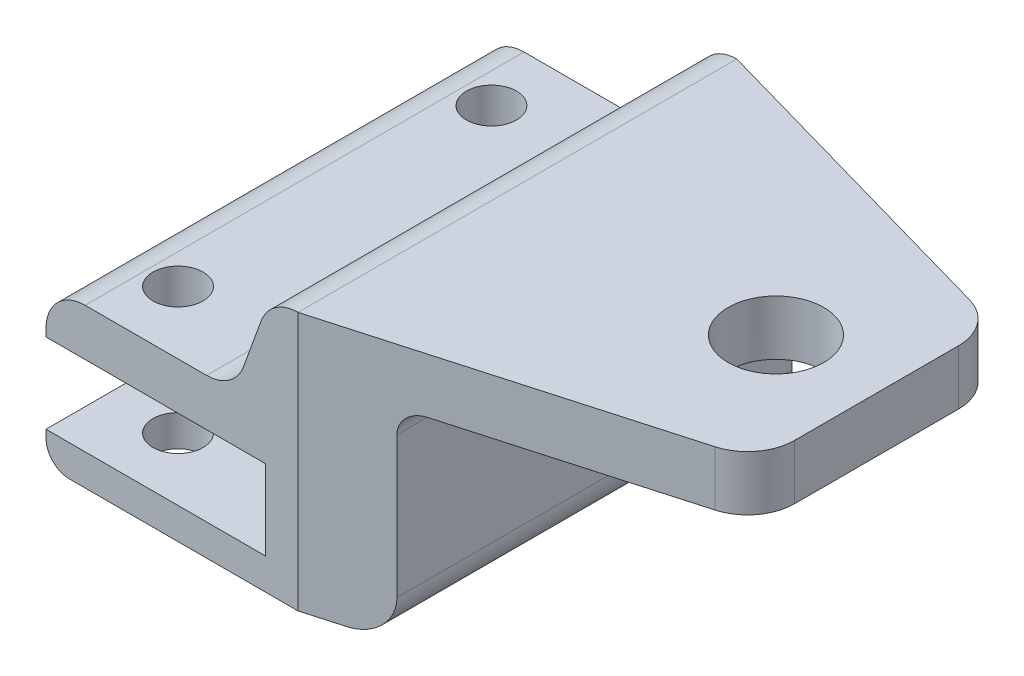
from build123d import *

# Parameters (mm, degrees)
BOSS_EXTRU_1_DEPTH      = 28
ESQUISSE2_R             = 1.6
ENL_V_MAT_EXTRU_1_DEPTH = 53.297323067
ESQUISSE3_R             = 3.05
ENL_V_MAT_EXTRU_2_DEPTH = 54.900371056


with BuildPart() as part:
    # Esquisse1 → Boss.-Extru.1 (new body)
    with BuildSketch(Plane.XY):
        with BuildLine():
            Line((1.5, 0), (18.5, 0))
            ThreePointArc((18.5, 0), (20.267766953, 0.732233047), (21, 2.5))
            Line((21, 2.5), (21, 11.5))
            ThreePointArc((21, 11.5), (21.439339828, 12.560660172), (22.5, 13))
            Line((22.5, 13), (43, 13))
            Line((43, 13), (43, 16.5))
            Line((43, 16.5), (16.079928345, 16.5))
            ThreePointArc((16.079928345, 16.5), (14.645987254, 16.047880111), (13.730696793, 14.855050358))
            Line((13.730696793, 14.855050358), (12.598712706, 11.744949642))
            ThreePointArc((12.598712706, 11.744949642), (11.683422245, 10.552119889), (10.249481154, 10.1))
            Line((10.249481154, 10.1), (2.5, 10.1))
            ThreePointArc((2.5, 10.1), (0.732233047, 9.367766953), (0, 7.6))
            Line((0, 7.6), (0, 7.1))
            Line((0, 7.1), (14, 7.1))
            Line((14, 7.1), (14, 2))
            Line((14, 2), (0, 2))
            Line((0, 2), (0, 1.5))
            ThreePointArc((0, 1.5), (0.439339828, 0.439339828), (1.5, 0))
        make_face()
    extrude(amount=BOSS_EXTRU_1_DEPTH)

    # Esquisse2 → Enlèv. mat.-Extru.1 (cut, through all)
    with BuildSketch(Plane(origin=(0, 10.1, 0), x_dir=(1, 0, 0), z_dir=(0, 1, 0))):
        with Locations(Location((4.42409693, -4, 0), (0, 0, 180))):
            Circle(ESQUISSE2_R)
        with Locations(Location((4.42409693, -24, 0), (0, 0, 180))):
            Circle(ESQUISSE2_R)
    extrude(amount=-ENL_V_MAT_EXTRU_1_DEPTH, mode=Mode.SUBTRACT)

    # Esquisse3 → Enlèv. mat.-Extru.2 (cut, through all)
    with BuildSketch(Plane(origin=(0, 16.5, 0), x_dir=(1, 0, 0), z_dir=(0, 1, 0))):
        with Locations(Location((32.579928345, -14, 0), (0, 0, 270))):
            Circle(ESQUISSE3_R)
        with BuildLine():
            Line((16.079928345, -28), (43, -28))
            Line((43, -28), (43, 0))
            Line((43, 0), (16.079928345, 0))
            Line((16.079928345, 0), (36.818504724, -5.881340534))
            ThreePointArc((36.818504724, -5.881340534), (38.393273299, -6.958588944), (39, -8.767523137))
            Line((39, -8.767523137), (39, -19.232476863))
            ThreePointArc((39, -19.232476863), (38.393273299, -21.041411056), (36.818504724, -22.118659466))
            Line((36.818504724, -22.118659466), (16.079928345, -28))
        make_face()
    extrude(amount=-ENL_V_MAT_EXTRU_2_DEPTH, mode=Mode.SUBTRACT)


solid = part.part
